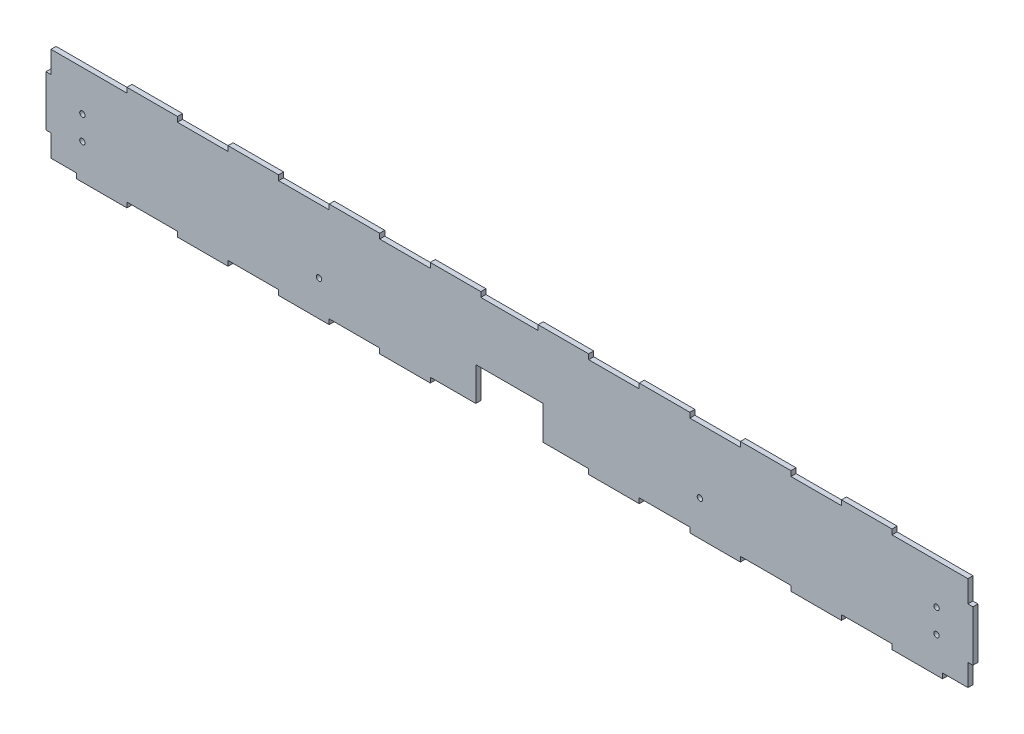
from build123d import *

# Parameters (mm, degrees)
SKETCH1_W           = 272
SKETCH1_H           = 56
BOSS_EXTRUDE1_DEPTH = 3
CUT_EXTRUDE1_REACH  = 275.454
SKETCH4_R           = 1.6
SKETCH4_W           = 20
SKETCH4_H           = 20
SKETCH5_W           = 3
SKETCH5_H           = 30
SKETCH5_W_2         = 30
SKETCH5_H_2         = 3
BOSS_EXTRUDE2_DEPTH = 3


with BuildPart() as part:
    # Sketch1 → Boss-Extrude1 (new body)
    with BuildSketch(Plane.XY):
        with Locations((136, 0)):
            Rectangle(SKETCH1_W, SKETCH1_H)
    extrude(amount=BOSS_EXTRUDE1_DEPTH)

    # Sketch4 → Cut-Extrude1 (cut, up to next)
    with BuildSketch(Plane.XY.offset(3), mode=Mode.PRIVATE) as cut_extrude1_sk1:
        with Locations((253.41, -10.06)):
            Circle(SKETCH4_R)
    cut_extrude1_tool1 = extrude(cut_extrude1_sk1.sketch, amount=-CUT_EXTRUDE1_REACH, mode=Mode.PRIVATE) & part.part
    # Sketch4 → Cut-Extrude1 (cut, up to next)
    with BuildSketch(Plane.XY.offset(3), mode=Mode.PRIVATE) as cut_extrude1_sk2:
        with Locations((253.41, 4.02)):
            Circle(SKETCH4_R)
    cut_extrude1_tool2 = extrude(cut_extrude1_sk2.sketch, amount=-CUT_EXTRUDE1_REACH, mode=Mode.PRIVATE) & part.part
    # Sketch4 → Cut-Extrude1 (cut, up to next)
    with BuildSketch(Plane.XY.offset(3), mode=Mode.PRIVATE) as cut_extrude1_sk3:
        with Locations((113, -10.06)):
            Circle(SKETCH4_R)
    cut_extrude1_tool3 = extrude(cut_extrude1_sk3.sketch, amount=-CUT_EXTRUDE1_REACH, mode=Mode.PRIVATE) & part.part
    # Sketch4 → Cut-Extrude1 (cut, up to next)
    with BuildSketch(Plane.XY.offset(3), mode=Mode.PRIVATE) as cut_extrude1_sk4:
        with Locations((10, -18)):
            Rectangle(SKETCH4_W, SKETCH4_H)
    cut_extrude1_tool4 = extrude(cut_extrude1_sk4.sketch, amount=-CUT_EXTRUDE1_REACH, mode=Mode.PRIVATE) & part.part
    add(cut_extrude1_tool1.solids().sort_by_distance((253.41, -10.06, 3))[0], mode=Mode.SUBTRACT)
    add(cut_extrude1_tool2.solids().sort_by_distance((253.41, 4.02, 3))[0], mode=Mode.SUBTRACT)
    add(cut_extrude1_tool3.solids().sort_by_distance((113, -10.06, 3))[0], mode=Mode.SUBTRACT)
    add(cut_extrude1_tool4.solids().sort_by_distance((10, -18, 3))[0], mode=Mode.SUBTRACT)

    # Sketch5 → Boss-Extrude2 (add)
    with BuildSketch(Plane.XY):
        with Locations((273.5, 0)):
            Rectangle(SKETCH5_W, SKETCH5_H)
        with Locations((212, 29.5)):
            Rectangle(SKETCH5_W_2, SKETCH5_H_2)
        with Locations((152, 29.5)):
            Rectangle(SKETCH5_W_2, SKETCH5_H_2)
        with Locations((92, 29.5)):
            Rectangle(SKETCH5_W_2, SKETCH5_H_2)
        with Locations((32, 29.5)):
            Rectangle(SKETCH5_W_2, SKETCH5_H_2)
        with Locations((242, -29.5)):
            Rectangle(SKETCH5_W_2, SKETCH5_H_2)
        with Locations((182, -29.5)):
            Rectangle(SKETCH5_W_2, SKETCH5_H_2)
        with Locations((122, -29.5)):
            Rectangle(SKETCH5_W_2, SKETCH5_H_2)
        with Locations((62, -29.5)):
            Rectangle(SKETCH5_W_2, SKETCH5_H_2)
    extrude(amount=BOSS_EXTRUDE2_DEPTH)

    # Mirror1: part across plane


with BuildPart() as part_1:
    add(part.part)
    add(part.part.mirror(Plane(origin=(0, -28, 3), x_dir=(0, 0, 1), z_dir=(1, 0, 0))))


solid = part_1.part
